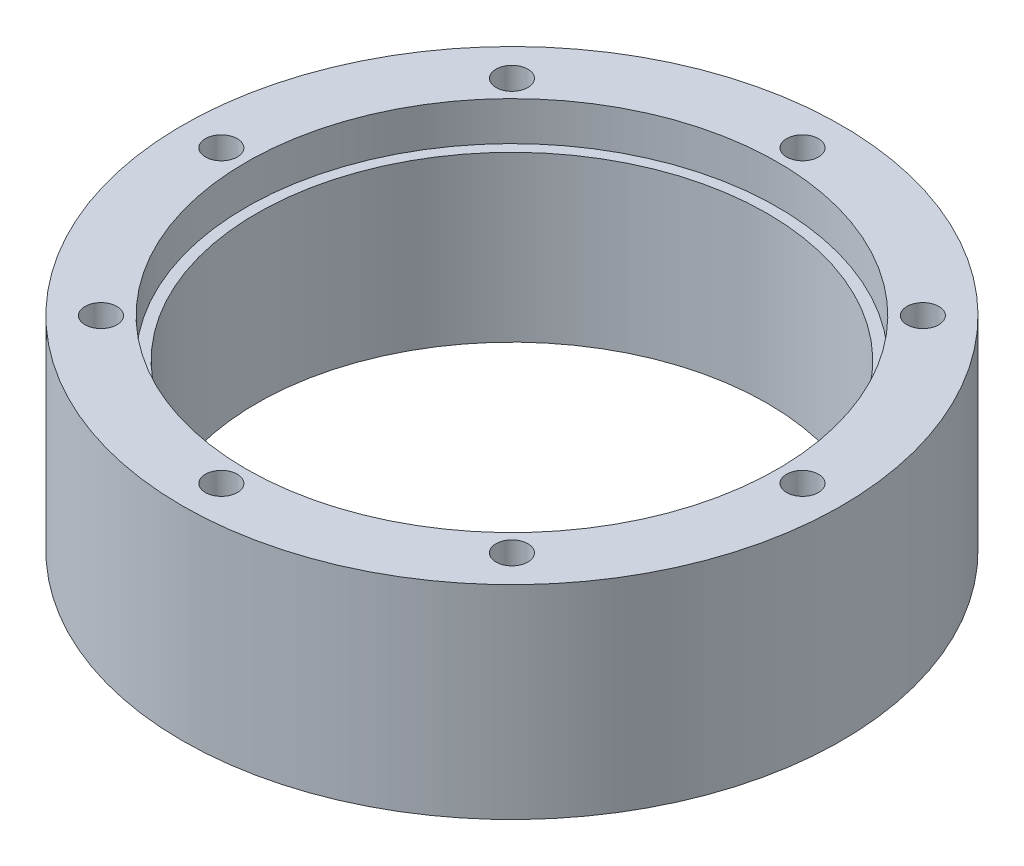
from build123d import *

# Parameters (mm, degrees)
SKETCH1_R           = 46.5
SKETCH1_R_2         = 36
BOSS_EXTRUDE1_DEPTH = 28.7
SKETCH2_R           = 2.25
CUT_EXTRUDE1_DEPTH  = 72.750888496
CUT_EXTRUDE2_START  = -5.5
SKETCH3_R           = 37.5
SKETCH3_R_2         = 36
CUT_EXTRUDE2_DEPTH  = 5.5


with BuildPart() as part:
    # Sketch1 → Boss-Extrude1 (new body)
    with BuildSketch(Plane(origin=(0, 0, 0), x_dir=(1, 0, 0), z_dir=(0, 1, 0))):
        with Locations(Location((0, 0, 0), (0, 0, 270))):
            Circle(SKETCH1_R)
        with Locations(Location((0, 0, 0), (0, 0, 270))):
            Circle(SKETCH1_R_2, mode=Mode.SUBTRACT)
    extrude(amount=BOSS_EXTRUDE1_DEPTH)

    # Sketch2 → Cut-Extrude1 (cut, through all)
    with BuildSketch(Plane(origin=(0, 28.7, 0), x_dir=(1, 0, 0), z_dir=(0, 1, 0))):
        with Locations(Location((0, 41, 0), (0, 0, 270))):
            Circle(SKETCH2_R)
        with Locations(Location((28.991378029, 28.991378029, 0), (0, 0, 270))):
            Circle(SKETCH2_R)
        with Locations(Location((41, 0, 0), (0, 0, 270))):
            Circle(SKETCH2_R)
        with Locations(Location((28.991378029, -28.991378029, 0), (0, 0, 270))):
            Circle(SKETCH2_R)
        with Locations(Location((0, -41, 0), (0, 0, 270))):
            Circle(SKETCH2_R)
        with Locations(Location((-28.991378029, -28.991378029, 0), (0, 0, 270))):
            Circle(SKETCH2_R)
        with Locations(Location((-41, 0, 0), (0, 0, 270))):
            Circle(SKETCH2_R)
        with Locations(Location((-28.991378029, 28.991378029, 0), (0, 0, 270))):
            Circle(SKETCH2_R)
    extrude(amount=-CUT_EXTRUDE1_DEPTH, mode=Mode.SUBTRACT)

    # Sketch3 → Cut-Extrude2 (cut)
    with BuildSketch(Plane(origin=(0, 28.7, 0), x_dir=(1, 0, 0), z_dir=(0, 1, 0)).offset(CUT_EXTRUDE2_START)):
        with Locations(Location((0, 0, 0), (0, 0, 270))):
            Circle(SKETCH3_R)
        with Locations(Location((0, 0, 0), (0, 0, 270))):
            Circle(SKETCH3_R_2, mode=Mode.SUBTRACT)
    extrude(amount=CUT_EXTRUDE2_DEPTH, mode=Mode.SUBTRACT)


solid = part.part
